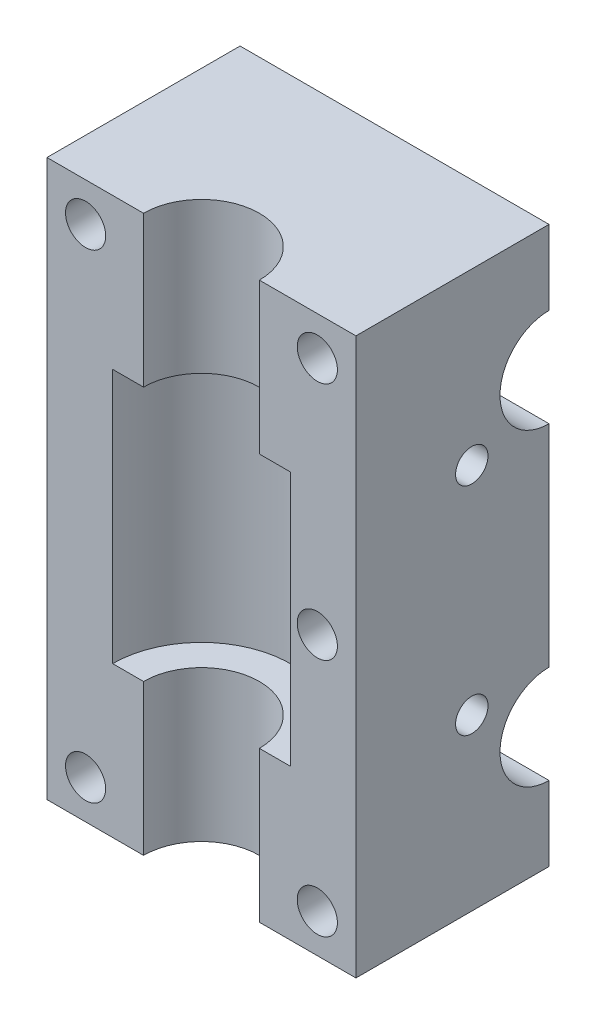
from build123d import *

# Parameters (mm, degrees)
BOSS_EXTRUDE1_DEPTH = 36
CUT_EXTRUDE1_DEPTH  = 16.5
CUT_EXTRUDE2_DEPTH  = 10
SKETCH4_R           = 2.1
CUT_EXTRUDE3_DEPTH  = 60.338014797
SKETCH5_R           = 2.6
CUT_EXTRUDE4_DEPTH  = 60.338014797


with BuildPart() as part:
    # Sketch1 → Boss-Extrude1 (new, symmetric)
    with BuildSketch(Plane(origin=(0, 0, 0), x_dir=(1, 0, 0), z_dir=(0, 1, 0))):
        with BuildLine():
            Line((27.5, 0), (40, 0))
            Line((40, 0), (40, 25))
            Line((40, 25), (0, 25))
            Line((0, 25), (0, 0))
            Line((0, 0), (12.5, 0))
            ThreePointArc((12.5, 0), (20, 7.5), (27.5, 0))
        make_face()
    extrude(amount=BOSS_EXTRUDE1_DEPTH, both=True)

    # Sketch2 → Cut-Extrude1 (cut, symmetric)
    with BuildSketch(Plane(origin=(0, 0, 0), x_dir=(1, 0, 0), z_dir=(0, 1, 0))):
        with BuildLine():
            Line((8.5, 0), (31.5, 0))
            ThreePointArc((31.5, 0), (20, 11.5), (8.5, 0))
        make_face()
    extrude(amount=CUT_EXTRUDE1_DEPTH, both=True, mode=Mode.SUBTRACT)

    # Sketch3 → Cut-Extrude2 (cut)
    with BuildSketch(Plane(origin=(40, 0, 0), x_dir=(0, 0, -1), z_dir=(1, 0, 0))):
        with BuildLine():
            Line((25, 26.35), (25, 13.65))
            ThreePointArc((25, 13.65), (18.65, 20), (25, 26.35))
        make_face()
        with BuildLine():
            Line((25, -13.65), (25, -26.35))
            ThreePointArc((25, -26.35), (18.65, -20), (25, -13.65))
        make_face()
    extrude(amount=-CUT_EXTRUDE2_DEPTH, mode=Mode.SUBTRACT)

    # Sketch4 → Cut-Extrude3 (cut, through all)
    with BuildSketch(Plane(origin=(40, 0, 0), x_dir=(0, 0, -1), z_dir=(1, 0, 0))):
        with Locations((15, 14)):
            Circle(SKETCH4_R)
        with Locations((15, -14)):
            Circle(SKETCH4_R)
    extrude(amount=-CUT_EXTRUDE3_DEPTH, mode=Mode.SUBTRACT)

    # Sketch5 → Cut-Extrude4 (cut, through all)
    with BuildSketch(Plane.XY):
        with Locations((5, 31)):
            Circle(SKETCH5_R)
        with Locations((35, 31)):
            Circle(SKETCH5_R)
        with Locations((35, -31)):
            Circle(SKETCH5_R)
        with Locations((5, -31)):
            Circle(SKETCH5_R)
        with Locations((35, 0)):
            Circle(SKETCH5_R)
    extrude(amount=-CUT_EXTRUDE4_DEPTH, mode=Mode.SUBTRACT)


solid = part.part
